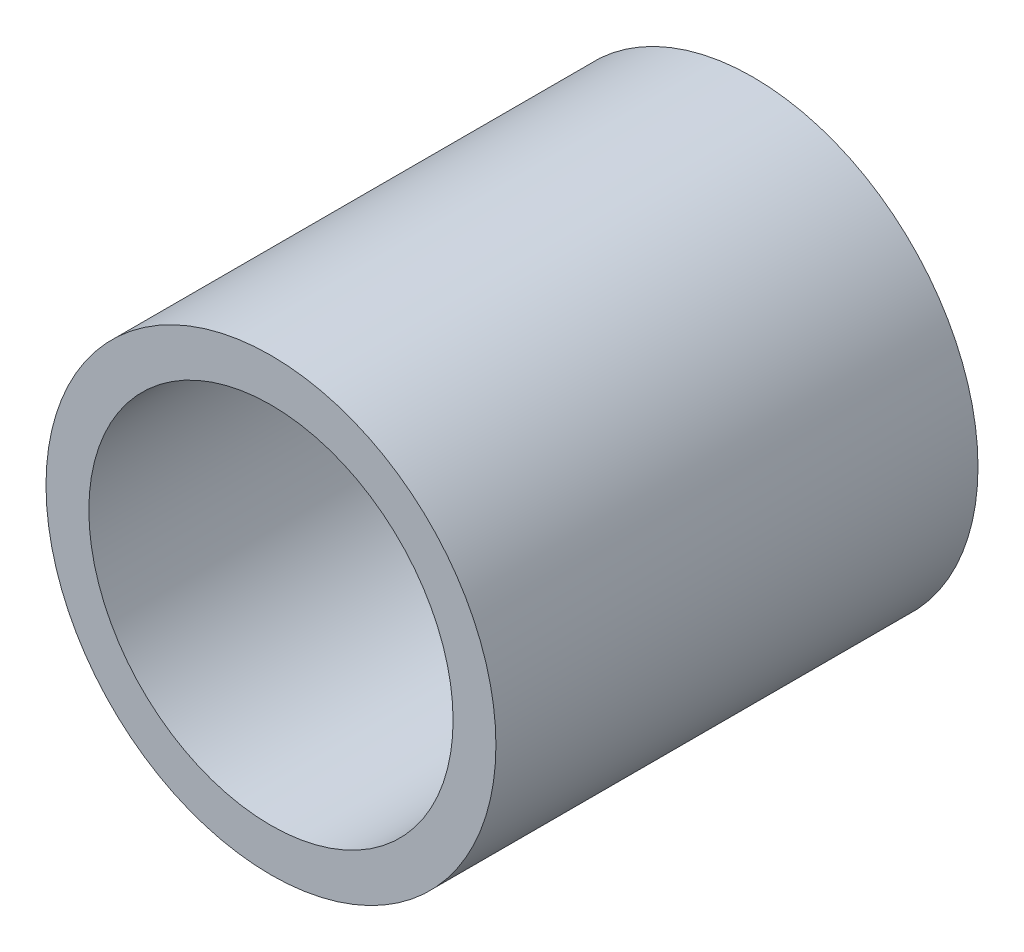
from build123d import *

# Parameters (mm, degrees)
SKETCH1_R           = 21
SKETCH1_R_2         = 17
BOSS_EXTRUDE1_DEPTH = 45


with BuildPart() as part:
    # Sketch1 → Boss-Extrude1 (new body)
    with BuildSketch(Plane.XY):
        with Locations(Location((0, 0, 0), (0, 0, 180))):
            Circle(SKETCH1_R)
        with Locations(Location((0, 0, 0), (0, 0, 180))):
            Circle(SKETCH1_R_2, mode=Mode.SUBTRACT)
    extrude(amount=BOSS_EXTRUDE1_DEPTH)


solid = part.part
